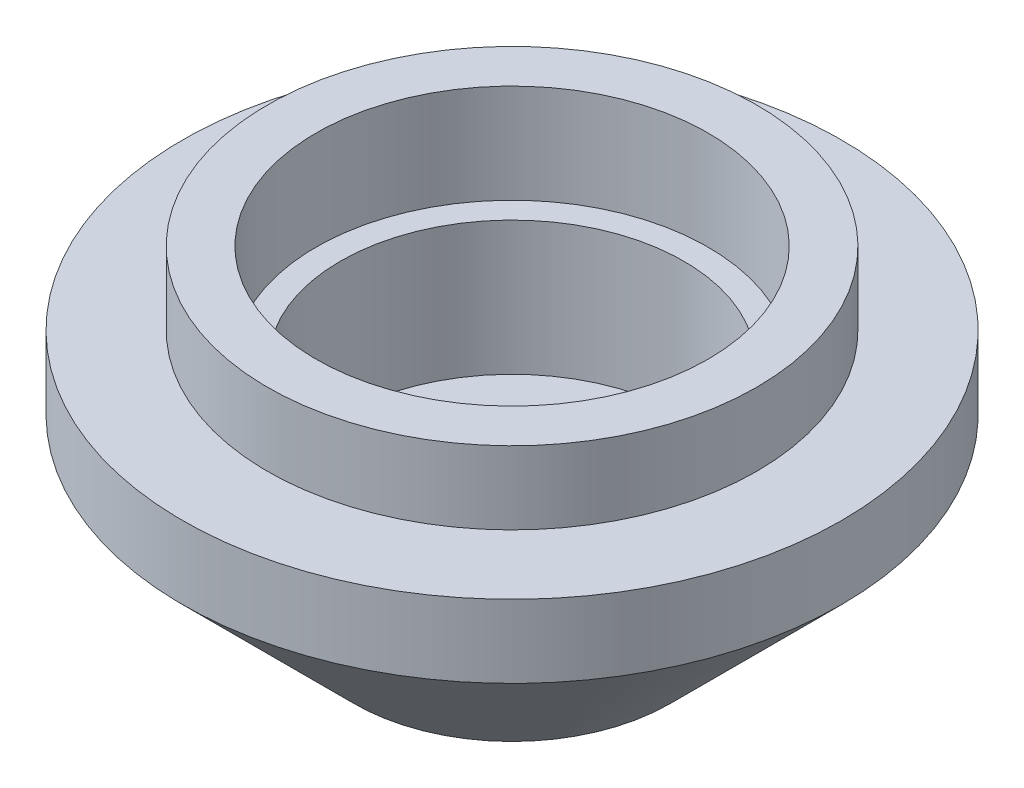
from build123d import *


with BuildPart() as part:
    # Sketch1 → Revolve1 (revolve)
    with BuildSketch(Plane.XY):
        Polygon((0, 0), (6.5, 0), (13.571067812, 7.071067812), (13.571067812, 10.071067812), (10.071067812, 10.071067812), (10.071067812, 13.071067812), (8.071067812, 13.071067812), (8.071067812, 9), (7.071067812, 9), (7.071067812, 3.5), (0, 3.5), align=None)
    revolve(axis=Axis((0, 0, 0), (0, 1, 0)))


solid = part.part
